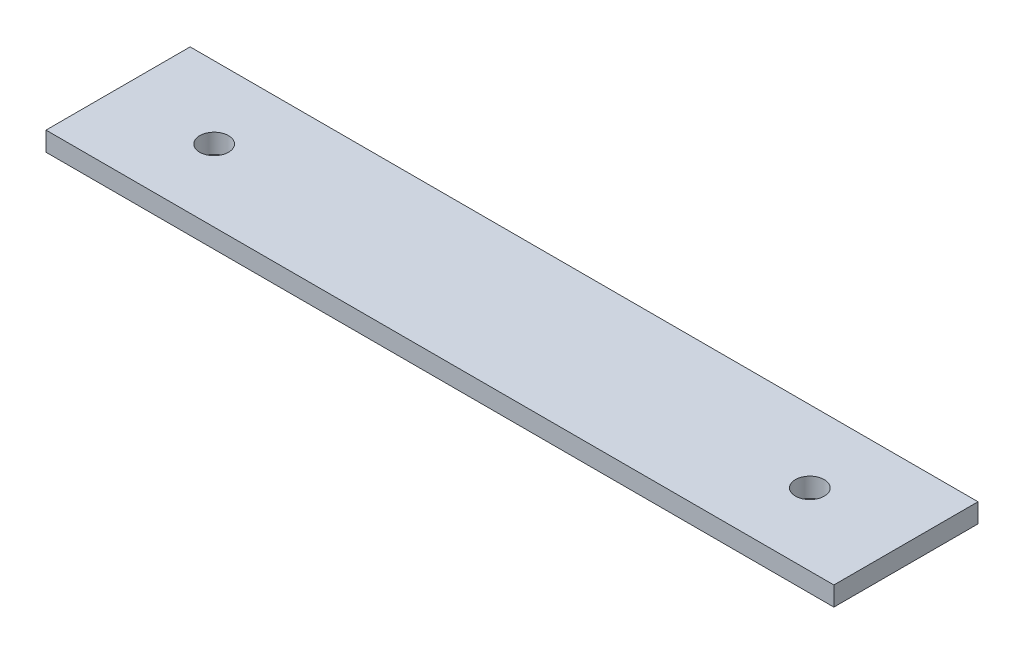
from build123d import *

# Parameters (mm, degrees)
SKETCH1_W           = 82
SKETCH1_H           = 15
SKETCH1_R           = 1.5
BOSS_EXTRUDE1_DEPTH = 2


with BuildPart() as part:
    # Sketch1 → Boss-Extrude1 (new body)
    with BuildSketch(Plane(origin=(0, 0, 0), x_dir=(1, 0, 0), z_dir=(0, 1, 0))):
        with Locations((41, 7.5)):
            Rectangle(SKETCH1_W, SKETCH1_H)
        with Locations(Location((10, 7.5, 0), (0, 0, 270))):
            Circle(SKETCH1_R, mode=Mode.SUBTRACT)
        with Locations(Location((72, 7.5, 0), (0, 0, 270))):
            Circle(SKETCH1_R, mode=Mode.SUBTRACT)
    extrude(amount=BOSS_EXTRUDE1_DEPTH)


solid = part.part
